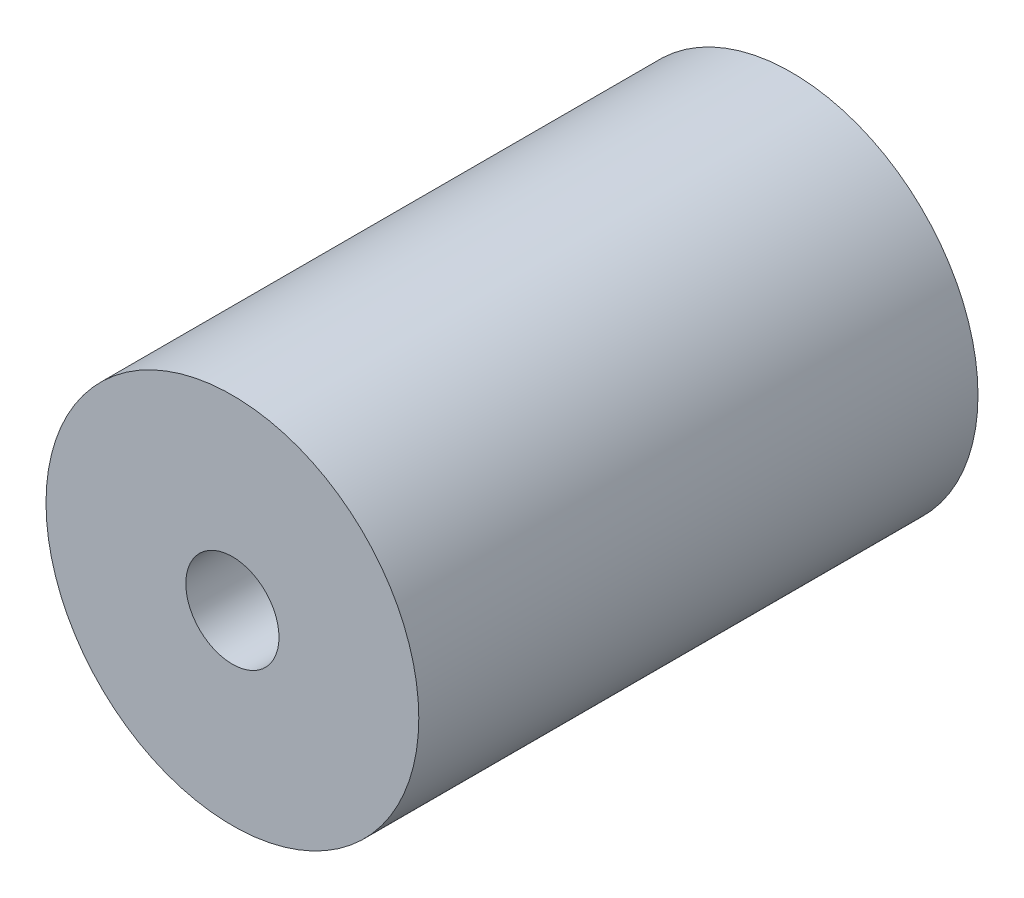
from build123d import *

# Parameters (mm, degrees)
PIPESKETCH_R    = 10
PIPESKETCH_R_2  = 2.5
EXTRUSION_DEPTH = 30


with BuildPart() as part:
    # PipeSketch → Extrusion (new body)
    with BuildSketch(Plane.XY):
        Circle(PIPESKETCH_R)
        Circle(PIPESKETCH_R_2, mode=Mode.SUBTRACT)
    extrude(amount=EXTRUSION_DEPTH)


solid = part.part
